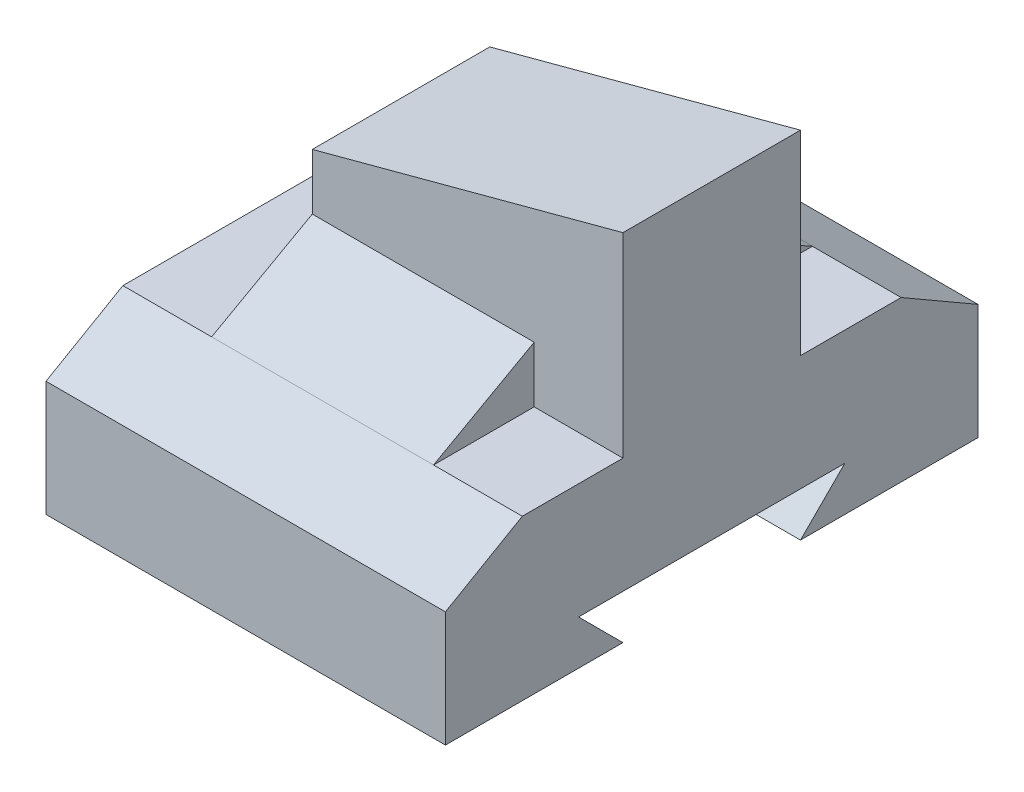
from build123d import *

# Parameters (mm, degrees)
RESSALTO_EXTRUS_O1_DEPTH   = 45
ESBO_O2_W                  = 20
ESBO_O2_H                  = 22
RESSALTO_EXTRUS_O2_DEPTH   = 35
CORTE_EXTRUS_O1_REACH      = 74.284
RESSALTO_EXTRUS_O3_DEPTH   = 25
RESSALTO_EXTRUS_O3_2_DEPTH = 25


with BuildPart() as part:
    # Esboço1 → Ressalto-extrusão1 (new body)
    with BuildSketch(Plane(origin=(0, 0, 0), x_dir=(0, 0, -1), z_dir=(1, 0, 0))):
        Polygon((-40, 0), (-45, 5), (-15, 5), (-20, 0), (0, 0), (0, 13), (-8.660254038, 18), (-51.339745962, 18), (-60, 13), (-60, 0), align=None)
    extrude(amount=-RESSALTO_EXTRUS_O1_DEPTH)

    # Esboço2 → Ressalto-extrusão2 (add)
    with BuildSketch(Plane(origin=(0, 0, 0), x_dir=(0, 0, -1), z_dir=(1, 0, 0))):
        with Locations((-30, 29)):
            Rectangle(ESBO_O2_W, ESBO_O2_H)
    extrude(amount=-RESSALTO_EXTRUS_O2_DEPTH)

    # Esboço3 → Corte-extrusão1 (cut, up to next)
    with BuildSketch(Plane.XY.offset(40), mode=Mode.PRIVATE) as corte_extrus_o1_sk1:
        Polygon((0, 40), (-35, 30.621778265), (-35, 40), align=None)
    corte_extrus_o1_tool1 = extrude(corte_extrus_o1_sk1.sketch, amount=-CORTE_EXTRUS_O1_REACH, mode=Mode.PRIVATE) & part.part
    add(corte_extrus_o1_tool1.solids().sort_by_distance((-23.333333, 36.873926, 40))[0], mode=Mode.SUBTRACT)


with BuildPart() as body_2:
    # Esboço4 → Ressalto-extrusão3 (new body)
    with BuildSketch(Plane.ZY.offset(35)):
        Polygon((8.660254038, 18), (20, 24.310889132), (20, 18), align=None)
    extrude(amount=-RESSALTO_EXTRUS_O3_DEPTH)


with BuildPart() as body_3:
    # Esboço4 → Ressalto-extrus_o3 2 (new body)
    with BuildSketch(Plane.ZY.offset(35)):
        Polygon((51.339745962, 18), (40, 24.310889132), (40, 18), align=None)
    extrude(amount=-RESSALTO_EXTRUS_O3_2_DEPTH)


solid = Compound([part.part, body_2.part, body_3.part])
